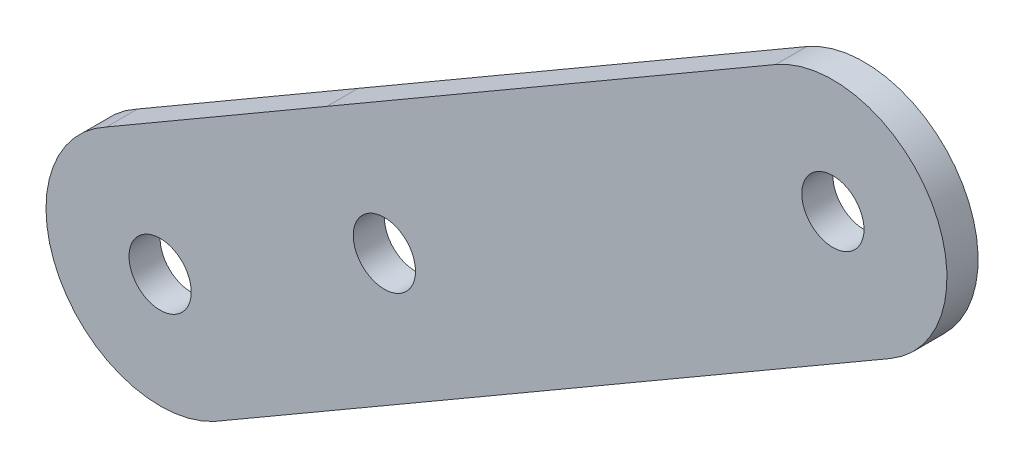
from build123d import *

# Parameters (mm, degrees)
SKETCH1_R           = 3
BOSS_EXTRUDE1_DEPTH = 3


with BuildPart() as part:
    # Sketch1 → Boss-Extrude1 (new body)
    with BuildSketch(Plane.XY):
        with BuildLine():
            Line((162.640616578, -47.437292702), (141.367093537, -59.798809878))
            ThreePointArc((141.367093537, -59.798809878), (136.844335561, -74.68318626), (151.728711943, -79.205944236))
            Line((151.728711943, -79.205944236), (152.402593626, -78.814873748))
            Line((152.402593626, -78.814873748), (173.688379763, -66.462196747))
            Line((173.688379763, -66.462196747), (216.929531333, -41.352308153))
            ThreePointArc((216.929531333, -41.352308153), (220.918167116, -26.315991874), (205.881850837, -22.32735609))
            Line((205.881850837, -22.32735609), (162.640616578, -47.437292702))
        make_face()
        with Locations((146.547901788, -69.502375418)):
            Circle(SKETCH1_R, mode=Mode.SUBTRACT)
        with Locations((168.167159933, -56.948185788)):
            Circle(SKETCH1_R, mode=Mode.SUBTRACT)
        with Locations((211.405691085, -31.839832122)):
            Circle(SKETCH1_R, mode=Mode.SUBTRACT)
    extrude(amount=BOSS_EXTRUDE1_DEPTH)


solid = part.part
